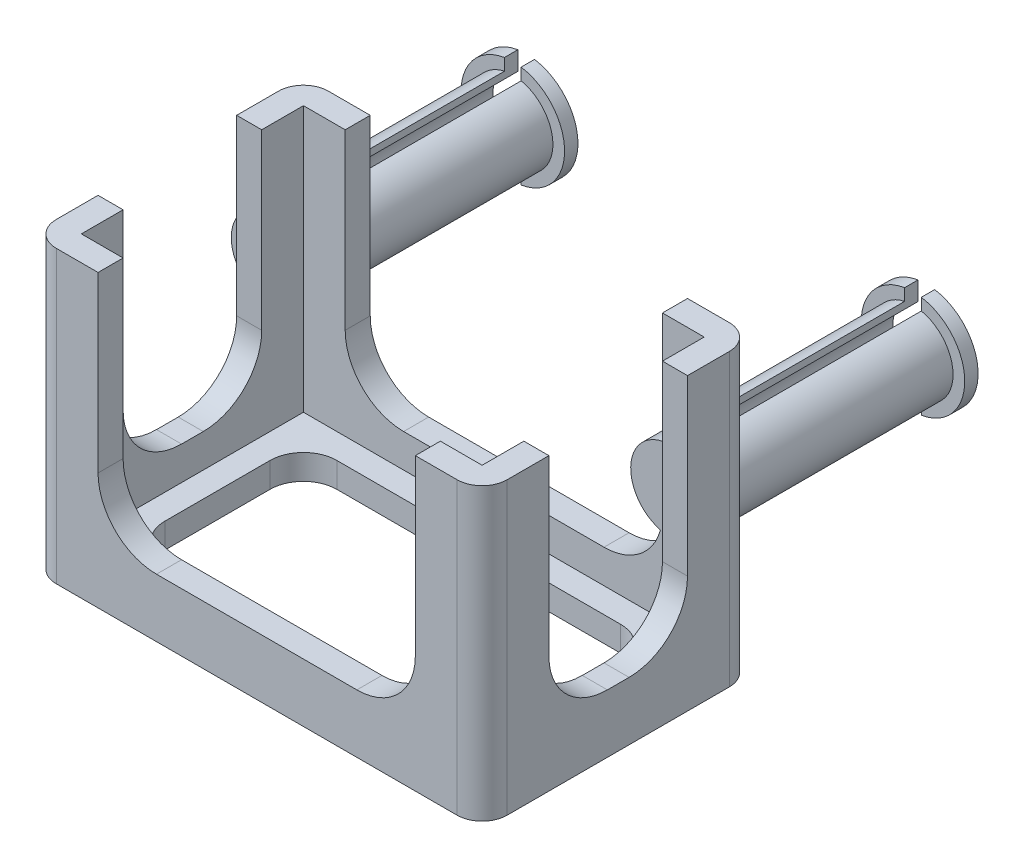
from build123d import *

# Parameters (mm, degrees)
SKETCH1_W                = 27
SKETCH1_H                = 16.3
BOSS_EXTRUDE1_DEPTH      = 17.4
SKETCH2_W                = 24
SKETCH2_H                = 13.3
CUT_EXTRUDE1_DEPTH       = 15.9
SKETCH3_W                = 19
SKETCH3_H                = 16.3
CUT_EXTRUDE2_DEPTH       = 13.9
SKETCH4_W                = 27
SKETCH4_H                = 8.3
CUT_EXTRUDE3_DEPTH       = 13.9
SKETCH6_R                = 3.69
BOSS_EXTRUDE2_DEPTH      = 2.38
SKETCH7_R                = 3.1
CUT_EXTRUDE4_DEPTH       = 0.8
SKETCH8_R                = 2.4
CUT_EXTRUDE5_DEPTH       = 4.8
CUT_EXTRUDE7_START       = -0.8
SKETCH9_R                = 3.1
CUT_EXTRUDE7_DEPTH       = 0.8
CUT_EXTRUDE8_DEPTH       = 10
FILLET1_R                = 3.5
FILLET2_R                = 3.5
FILLET3_R                = 3.5
FILLET4_R                = 3.5
FILLET5_R                = 3.5
FILLET6_R                = 3.5
FILLET7_R                = 3.5
FILLET8_R                = 3.5
FILLET9_R                = 1.5
FILLET10_R               = 1.5
FILLET11_R               = 1.5
FILLET12_R               = 1.5
SKETCH11_W               = 20
SKETCH11_H               = 4.569127273
CUT_EXTRUDE10_DEPTH      = 35
SKETCH12_W               = 26.121320344
SKETCH12_H               = 15.421320343
BOSS_EXTRUDE3_DEPTH      = 1.5
BOSS_EXTRUDE4_DEPTH      = 13.76
BOSS_EXTRUDE4_DEPTH_BACK = 1.5
SKETCH14_R               = 2.4
SKETCH15_R               = 3.1
BOSS_EXTRUDE6_DEPTH      = 0.8
SKETCH17_R               = 2
CUT_EXTRUDE11_DEPTH      = 11.8
SKETCH18_W               = 1
SKETCH18_H               = 8
CUT_EXTRUDE12_DEPTH      = 11.8
BOSS_EXTRUDE7_DEPTH      = 13.803772877
BOSS_EXTRUDE7_DEPTH_BACK = 1.5
SKETCH19_R               = 2.4
SKETCH20_R               = 3.1
BOSS_EXTRUDE8_DEPTH      = 0.8
SKETCH21_R               = 2
CUT_EXTRUDE13_DEPTH      = 11.8
SKETCH22_W               = 1
SKETCH22_H               = 7.748272369
CUT_EXTRUDE14_DEPTH      = 11.8
CUT_EXTRUDE15_DEPTH      = 11.8


with BuildPart() as part:
    # Sketch1 → Boss-Extrude1 (new body)
    with BuildSketch(Plane(origin=(0, 0, 0), x_dir=(1, 0, 0), z_dir=(0, 1, 0))):
        with Locations((-24.874612789, -13.014611924)):
            Rectangle(SKETCH1_W, SKETCH1_H)
    extrude(amount=BOSS_EXTRUDE1_DEPTH)

    # Sketch2 → Cut-Extrude1 (cut)
    with BuildSketch(Plane(origin=(0, 17.4, 0), x_dir=(1, 0, 0), z_dir=(0, 1, 0))):
        with Locations((-24.874612789, -13.014611924)):
            Rectangle(SKETCH2_W, SKETCH2_H)
    extrude(amount=-CUT_EXTRUDE1_DEPTH, mode=Mode.SUBTRACT)

    # Sketch3 → Cut-Extrude2 (cut)
    with BuildSketch(Plane(origin=(0, 17.4, 0), x_dir=(1, 0, 0), z_dir=(0, 1, 0))):
        with Locations((-24.874612789, -13.014611924)):
            Rectangle(SKETCH3_W, SKETCH3_H)
    extrude(amount=-CUT_EXTRUDE2_DEPTH, mode=Mode.SUBTRACT)

    # Sketch4 → Cut-Extrude3 (cut)
    with BuildSketch(Plane(origin=(0, 17.4, 0), x_dir=(1, 0, 0), z_dir=(0, 1, 0))):
        with Locations((-24.874612789, -13.014611924)):
            Rectangle(SKETCH4_W, SKETCH4_H)
    extrude(amount=-CUT_EXTRUDE3_DEPTH, mode=Mode.SUBTRACT)

    # Sketch6 → Boss-Extrude2 (add)
    with BuildSketch(Plane(origin=(0, 0, 0), x_dir=(-1, 0, 0), z_dir=(0, -1, 0))):
        with Locations(Location((32.844612789, -9.029611924, 0), (0, 0, 90))):
            Circle(SKETCH6_R)
        with Locations(Location((32.844612789, -16.999611924, 0), (0, 0, 90))):
            Circle(SKETCH6_R)
        with Locations(Location((16.904612789, -9.029611924, 0), (0, 0, 90))):
            Circle(SKETCH6_R)
        with Locations(Location((16.904612789, -16.999611924, 0), (0, 0, 90))):
            Circle(SKETCH6_R)
    extrude(amount=BOSS_EXTRUDE2_DEPTH)

    # Sketch7 → Cut-Extrude4 (cut)
    with BuildSketch(Plane(origin=(0, -2.38, 0), x_dir=(-1, 0, 0), z_dir=(0, -1, 0))):
        with Locations(Location((32.844612789, -9.029611924, 0), (0, 0, 90))):
            Circle(SKETCH7_R)
        with Locations(Location((32.844612789, -16.999611924, 0), (0, 0, 90))):
            Circle(SKETCH7_R)
        with Locations(Location((16.904612789, -16.999611924, 0), (0, 0, 90))):
            Circle(SKETCH7_R)
        with Locations(Location((16.904612789, -9.029611924, 0), (0, 0, 90))):
            Circle(SKETCH7_R)
    extrude(amount=-CUT_EXTRUDE4_DEPTH, mode=Mode.SUBTRACT)

    # Sketch8 → Cut-Extrude5 (cut)
    with BuildSketch(Plane(origin=(0, -1.58, 0), x_dir=(-1, 0, 0), z_dir=(0, -1, 0))):
        with Locations(Location((32.844612789, -9.029611924, 0), (0, 0, 90))):
            Circle(SKETCH8_R)
        with Locations(Location((32.844612789, -16.999611924, 0), (0, 0, 90))):
            Circle(SKETCH8_R)
        with Locations(Location((16.904612789, -16.999611924, 0), (0, 0, 90))):
            Circle(SKETCH8_R)
        with Locations(Location((16.904612789, -9.029611924, 0), (0, 0, 90))):
            Circle(SKETCH8_R)
    extrude(amount=-CUT_EXTRUDE5_DEPTH, mode=Mode.SUBTRACT)

    # Sketch9 → Cut-Extrude7 (cut)
    with BuildSketch(Plane(origin=(0, 1.5, 0), x_dir=(1, 0, 0), z_dir=(0, 1, 0)).offset(CUT_EXTRUDE7_START)):
        with Locations(Location((-16.904612789, -16.999611924, 0), (0, 0, 90))):
            Circle(SKETCH9_R)
        with Locations(Location((-16.904612789, -9.029611924, 0), (0, 0, 90))):
            Circle(SKETCH9_R)
        with Locations(Location((-32.844612789, -9.029611924, 0), (0, 0, 90))):
            Circle(SKETCH9_R)
        with Locations(Location((-32.844612789, -16.999611924, 0), (0, 0, 90))):
            Circle(SKETCH9_R)
    extrude(amount=CUT_EXTRUDE7_DEPTH, mode=Mode.SUBTRACT)

    # Sketch10 → Cut-Extrude8 (cut)
    with BuildSketch(Plane(origin=(0, 1.5, 0), x_dir=(1, 0, 0), z_dir=(0, 1, 0))):
        with BuildLine():
            Line((-22.404612789, -7.864611924), (-27.344612789, -7.864611924))
            ThreePointArc((-27.344612789, -7.864611924), (-28.405272961, -8.303951753), (-28.844612789, -9.364611924))
            Line((-28.844612789, -9.364611924), (-28.844612789, -16.664611924))
            ThreePointArc((-28.844612789, -16.664611924), (-28.405272961, -17.725272096), (-27.344612789, -18.164611924))
            Line((-27.344612789, -18.164611924), (-22.404612789, -18.164611924))
            ThreePointArc((-22.404612789, -18.164611924), (-21.343952617, -17.725272096), (-20.904612789, -16.664611924))
            Line((-20.904612789, -16.664611924), (-20.904612789, -9.364611924))
            ThreePointArc((-20.904612789, -9.364611924), (-21.343952617, -8.303951753), (-22.404612789, -7.864611924))
        make_face()
    extrude(amount=-CUT_EXTRUDE8_DEPTH, mode=Mode.SUBTRACT)

    # Fillet1
    fillet1_edges = [part.edges().sort_by_distance(p)[0] for p in [
        (-15.374612789, 3.5, 5.614611924),
    ]]
    fillet(fillet1_edges, radius=FILLET1_R)

    # Fillet2
    fillet2_edges = [part.edges().sort_by_distance(p)[0] for p in [
        (-15.374612789, 3.5, 20.414611924),
    ]]
    fillet(fillet2_edges, radius=FILLET2_R)

    # Fillet3
    fillet3_edges = [part.edges().sort_by_distance(p)[0] for p in [
        (-12.124612789, 3.5, 17.164611924),
    ]]
    fillet(fillet3_edges, radius=FILLET3_R)

    # Fillet4
    fillet4_edges = [part.edges().sort_by_distance(p)[0] for p in [
        (-12.124612789, 3.5, 8.864611924),
    ]]
    fillet(fillet4_edges, radius=FILLET4_R)

    # Fillet5
    fillet5_edges = [part.edges().sort_by_distance(p)[0] for p in [
        (-37.624612789, 3.5, 8.864611924),
    ]]
    fillet(fillet5_edges, radius=FILLET5_R)

    # Fillet6
    fillet6_edges = [part.edges().sort_by_distance(p)[0] for p in [
        (-37.624612789, 3.5, 17.164611924),
    ]]
    fillet(fillet6_edges, radius=FILLET6_R)

    # Fillet7
    fillet7_edges = [part.edges().sort_by_distance(p)[0] for p in [
        (-34.374612789, 3.5, 5.614611924),
    ]]
    fillet(fillet7_edges, radius=FILLET7_R)

    # Fillet8
    fillet8_edges = [part.edges().sort_by_distance(p)[0] for p in [
        (-34.374612789, 3.5, 20.414611924),
    ]]
    fillet(fillet8_edges, radius=FILLET8_R)

    # Fillet9
    fillet9_edges = [part.edges().sort_by_distance(p)[0] for p in [
        (-38.374612789, 8.7, 21.164611924),
    ]]
    fillet(fillet9_edges, radius=FILLET9_R)

    # Fillet10
    fillet10_edges = [part.edges().sort_by_distance(p)[0] for p in [
        (-38.374612789, 8.7, 4.864611924),
    ]]
    fillet(fillet10_edges, radius=FILLET10_R)

    # Fillet11
    fillet11_edges = [part.edges().sort_by_distance(p)[0] for p in [
        (-11.374612789, 8.7, 4.864611924),
    ]]
    fillet(fillet11_edges, radius=FILLET11_R)

    # Fillet12
    fillet12_edges = [part.edges().sort_by_distance(p)[0] for p in [
        (-11.374612789, 8.7, 21.164611924),
    ]]
    fillet(fillet12_edges, radius=FILLET12_R)

    # Sketch11 → Cut-Extrude10 (cut)
    with BuildSketch(Plane(origin=(-11.374612789, 0, 0), x_dir=(0, 0, -1), z_dir=(1, 0, 0))):
        with Locations((-11.164611924, -2.284563637)):
            Rectangle(SKETCH11_W, SKETCH11_H)
    extrude(amount=-CUT_EXTRUDE10_DEPTH, mode=Mode.SUBTRACT)

    # Sketch12 → Boss-Extrude3 (add)
    with BuildSketch(Plane(origin=(0, 0, 0), x_dir=(-1, 0, 0), z_dir=(0, -1, 0))):
        with Locations((24.874612789, -13.014611925)):
            Rectangle(SKETCH12_W, SKETCH12_H)
    extrude(amount=-BOSS_EXTRUDE3_DEPTH)

    # Sketch14 → Boss-Extrude4 (add, two sides: drawn at the far end of the back side and taken through both)
    with BuildSketch(Plane(origin=(-4.421362725, 0, 4.864611924), x_dir=(-1, 0, 0), z_dir=(0, 0, -1)).offset(-BOSS_EXTRUDE4_DEPTH_BACK)):
        with Locations(Location((34.374612789, 8.4, 0), (0, 0, 143.184357726))):
            Circle(SKETCH14_R)
    extrude(amount=BOSS_EXTRUDE4_DEPTH + BOSS_EXTRUDE4_DEPTH_BACK)

    # Sketch15 → Boss-Extrude6 (add)
    with BuildSketch(Plane(origin=(-4.421362725, 0, -8.895388076), x_dir=(-1, 0, 0), z_dir=(0, 0, -1))):
        with Locations((34.374612789, 8.4)):
            Circle(SKETCH15_R)
    extrude(amount=-BOSS_EXTRUDE6_DEPTH)

    # Sketch17 → Cut-Extrude11 (cut)
    with BuildSketch(Plane(origin=(-4.421362725, 0, -8.895388076), x_dir=(-1, 0, 0), z_dir=(0, 0, -1))):
        with Locations((34.374612789, 8.4)):
            Circle(SKETCH17_R)
    extrude(amount=-CUT_EXTRUDE11_DEPTH, mode=Mode.SUBTRACT)

    # Sketch18 → Cut-Extrude12 (cut)
    with BuildSketch(Plane(origin=(-4.421362725, 0, -8.895388076), x_dir=(-1, 0, 0), z_dir=(0, 0, -1))):
        with Locations((34.374612789, 8.4)):
            Rectangle(SKETCH18_W, SKETCH18_H)
    extrude(amount=-CUT_EXTRUDE12_DEPTH, mode=Mode.SUBTRACT)

    # Sketch19 → Boss-Extrude7 (add, two sides: drawn at the far end of the back side and taken through both)
    with BuildSketch(Plane(origin=(0, 0, 4.864611924), x_dir=(-1, 0, 0), z_dir=(0, 0, -1)).offset(-BOSS_EXTRUDE7_DEPTH_BACK)):
        with Locations((14.875975514, 8.4)):
            Circle(SKETCH19_R)
    extrude(amount=BOSS_EXTRUDE7_DEPTH + BOSS_EXTRUDE7_DEPTH_BACK)

    # Sketch20 → Boss-Extrude8 (add)
    with BuildSketch(Plane(origin=(0, 0, -8.939160952), x_dir=(-1, 0, 0), z_dir=(0, 0, -1))):
        with Locations((14.875975514, 8.4)):
            Circle(SKETCH20_R)
    extrude(amount=-BOSS_EXTRUDE8_DEPTH)

    # Sketch21 → Cut-Extrude13 (cut)
    with BuildSketch(Plane(origin=(0, 0, -8.939160952), x_dir=(-1, 0, 0), z_dir=(0, 0, -1))):
        with Locations((14.875975514, 8.4)):
            Circle(SKETCH21_R)
    extrude(amount=-CUT_EXTRUDE13_DEPTH, mode=Mode.SUBTRACT)

    # Sketch22 → Cut-Extrude14 (cut)
    with BuildSketch(Plane(origin=(0, 0, -8.939160952), x_dir=(-1, 0, 0), z_dir=(0, 0, -1))):
        with Locations((14.875975514, 8.525863815)):
            Rectangle(SKETCH22_W, SKETCH22_H)
    extrude(amount=-CUT_EXTRUDE14_DEPTH, mode=Mode.SUBTRACT)

    # Sketch23 → Cut-Extrude15 (cut)
    with BuildSketch(Plane(origin=(0, 1.5, 0), x_dir=(1, 0, 0), z_dir=(0, 1, 0))):
        with BuildLine():
            Line((-33.374612789, -7.864611924), (-16.374612789, -7.864611924))
            ThreePointArc((-16.374612789, -7.864611924), (-14.960399227, -8.450398362), (-14.374612789, -9.864611924))
            Line((-14.374612789, -9.864611924), (-14.374612789, -16.164611924))
            ThreePointArc((-14.374612789, -16.164611924), (-14.960399227, -17.578825487), (-16.374612789, -18.164611924))
            Line((-16.374612789, -18.164611924), (-33.374612789, -18.164611924))
            ThreePointArc((-33.374612789, -18.164611924), (-34.788826352, -17.578825487), (-35.374612789, -16.164611924))
            Line((-35.374612789, -16.164611924), (-35.374612789, -9.864611924))
            ThreePointArc((-35.374612789, -9.864611924), (-34.788826352, -8.450398362), (-33.374612789, -7.864611924))
        make_face()
    extrude(amount=-CUT_EXTRUDE15_DEPTH, mode=Mode.SUBTRACT)


solid = part.part
